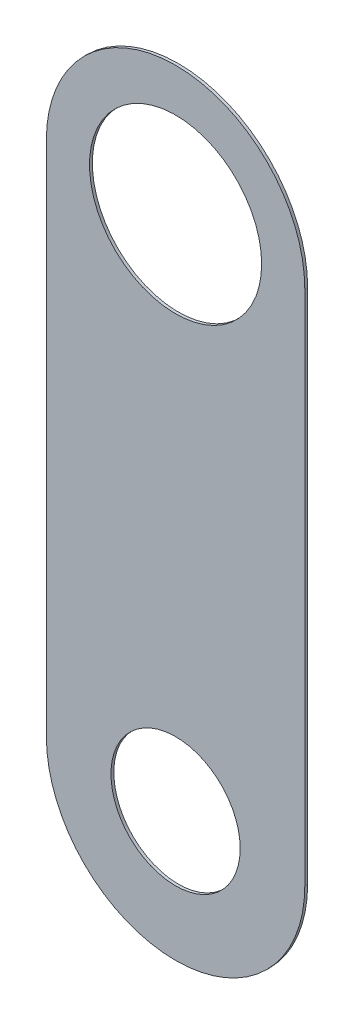
from build123d import *

# Parameters (mm, degrees)
BOSS_EXTRUDE1_DEPTH = 0.5588
SKETCH2_R           = 16.9164
SKETCH2_R_2         = 12.7
CUT_EXTRUDE1_DEPTH  = 137.784327529


with BuildPart() as part:
    # Sketch1 → Boss-Extrude1 (new body)
    with BuildSketch(Plane.XY):
        with BuildLine():
            Line((0, 0), (0, 101.6))
            ThreePointArc((0, 101.6), (25.4, 127), (50.8, 101.6))
            Line((50.8, 101.6), (50.8, 0))
            ThreePointArc((50.8, 0), (25.4, -25.4), (0, 0))
        make_face()
    extrude(amount=BOSS_EXTRUDE1_DEPTH)

    # Sketch2 → Cut-Extrude1 (cut, through all)
    with BuildSketch(Plane.XY.offset(0.5588)):
        with Locations((25.4, 101.6)):
            Circle(SKETCH2_R)
        with Locations((25.4, 0)):
            Circle(SKETCH2_R_2)
    extrude(amount=-CUT_EXTRUDE1_DEPTH, mode=Mode.SUBTRACT)


solid = part.part
